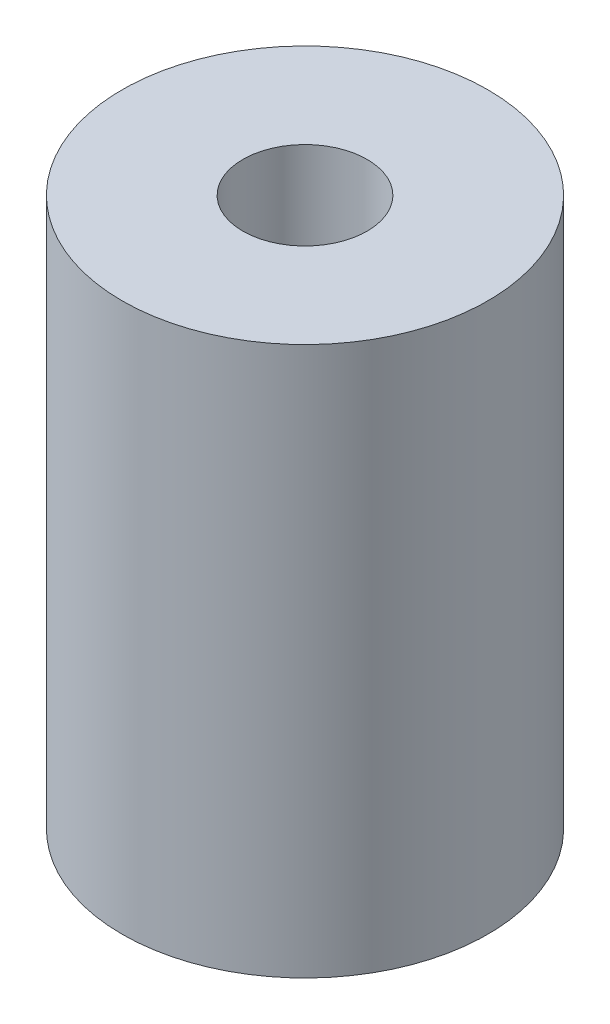
from build123d import *

# Parameters (mm, degrees)
SKETCH_1_R      = 5
SKETCH_1_R_2    = 1.7
EXTRUDE_1_DEPTH = 15


with BuildPart() as part:
    # 草图1 → 凸台-拉伸1 (new body)
    with BuildSketch(Plane(origin=(0, 0, 0), x_dir=(1, 0, 0), z_dir=(0, 1, 0))):
        with Locations(Location((0, 0, 0), (0, 0, 270))):
            Circle(SKETCH_1_R)
        with Locations(Location((0, 0, 0), (0, 0, 270))):
            Circle(SKETCH_1_R_2, mode=Mode.SUBTRACT)
    extrude(amount=EXTRUDE_1_DEPTH)


solid = part.part
